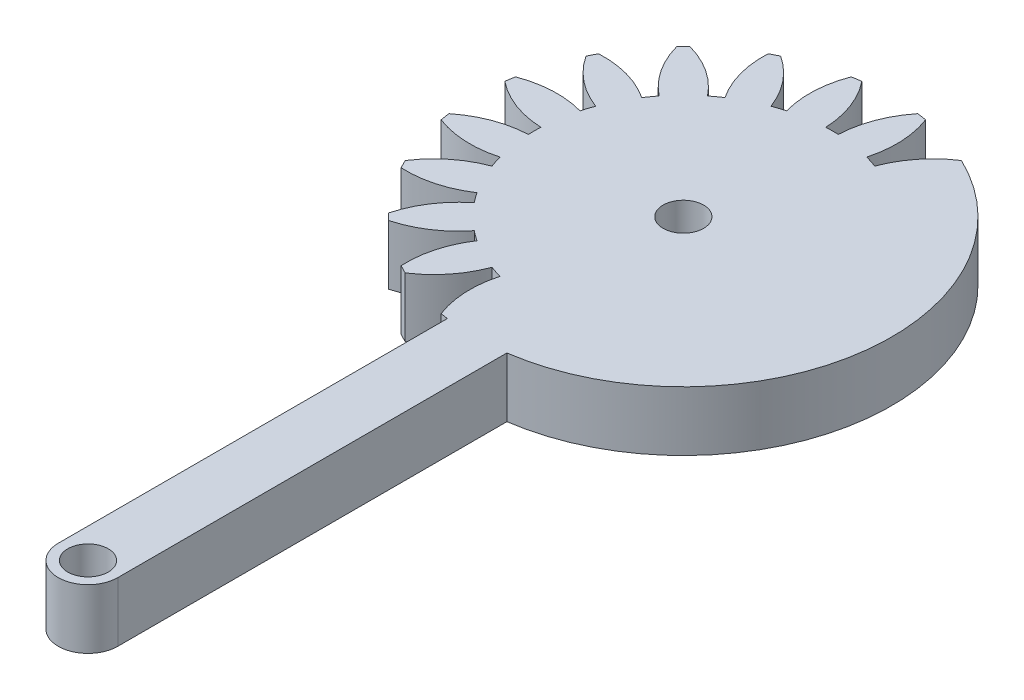
from build123d import *

# Parameters (mm, degrees)
SKETCH1_R           = 22.225
SKETCH1_R_2         = 2.159
BOSS_EXTRUDE1_DEPTH = 6.35
CUT_EXTRUDE1_DEPTH  = 33.065928179
CIRPATTERN1_COUNT   = 20
BOSS_EXTRUDE2_START = -6.35
SKETCH3_R           = 2.159
BOSS_EXTRUDE2_DEPTH = 6.35


with BuildPart() as part:
    # Sketch1 → Boss-Extrude1 (new body)
    with BuildSketch(Plane(origin=(0, 0, 0), x_dir=(1, 0, 0), z_dir=(0, 1, 0))):
        with Locations(Location((0, 0, 0), (0, 0, 270))):
            Circle(SKETCH1_R)
        with Locations(Location((0, 0, 0), (0, 0, 270))):
            Circle(SKETCH1_R_2, mode=Mode.SUBTRACT)
    extrude(amount=BOSS_EXTRUDE1_DEPTH)

    # Sketch2 → Cut-Extrude1 (cut, through all)
    with BuildSketch(Plane(origin=(0, 6.35, 0), x_dir=(1, 0, 0), z_dir=(0, 1, 0))):
        with BuildLine():
            ThreePointArc((0.664641226, 15.861080576), (0, 15.875), (-0.664641226, 15.861080576))
            ThreePointArc((-0.664641226, 15.861080576), (-1.329908729, 19.128362584), (-2.983334333, 22.023858455))
            ThreePointArc((-2.983334333, 22.023858455), (0, 22.225), (2.983334333, 22.023858455))
            ThreePointArc((2.983334333, 22.023858455), (1.329908729, 19.128362584), (0.664641226, 15.861080576))
        make_face()
    cut_extrude1 = extrude(amount=-CUT_EXTRUDE1_DEPTH, mode=Mode.SUBTRACT)

    # CirPattern1: Cut-Extrude1 ×20 about axis
    cirpattern1_axis = Axis((0, 0, 0), (0, 1, 0))
    for i in range(1, CIRPATTERN1_COUNT):
        add(cut_extrude1.rotate(cirpattern1_axis, i * 360 / CIRPATTERN1_COUNT), mode=Mode.SUBTRACT)

    # Sketch3 → Boss-Extrude2 (add)
    with BuildSketch(Plane(origin=(0, 6.35, 0), x_dir=(1, 0, 0), z_dir=(0, 1, 0)).offset(BOSS_EXTRUDE2_START)):
        with BuildLine():
            Line((3.175, -21.997045256), (3.175, -63.5))
            ThreePointArc((3.175, -63.5), (0, -66.675), (-3.175, -63.5))
            Line((-3.175, -63.5), (-3.175, 4.58754015))
            Line((-3.175, 4.58754015), (10.089938857, 19.80262))
            ThreePointArc((10.089938857, 19.80262), (21.926984622, -3.62739168), (3.175, -21.997045256))
        make_face()
        with Locations(Location((0, -63.5, 0), (0, 0, 270))):
            Circle(SKETCH3_R, mode=Mode.SUBTRACT)
        with Locations(Location((0, 0, 0), (0, 0, 270))):
            Circle(SKETCH3_R, mode=Mode.SUBTRACT)
    extrude(amount=BOSS_EXTRUDE2_DEPTH)


solid = part.part
